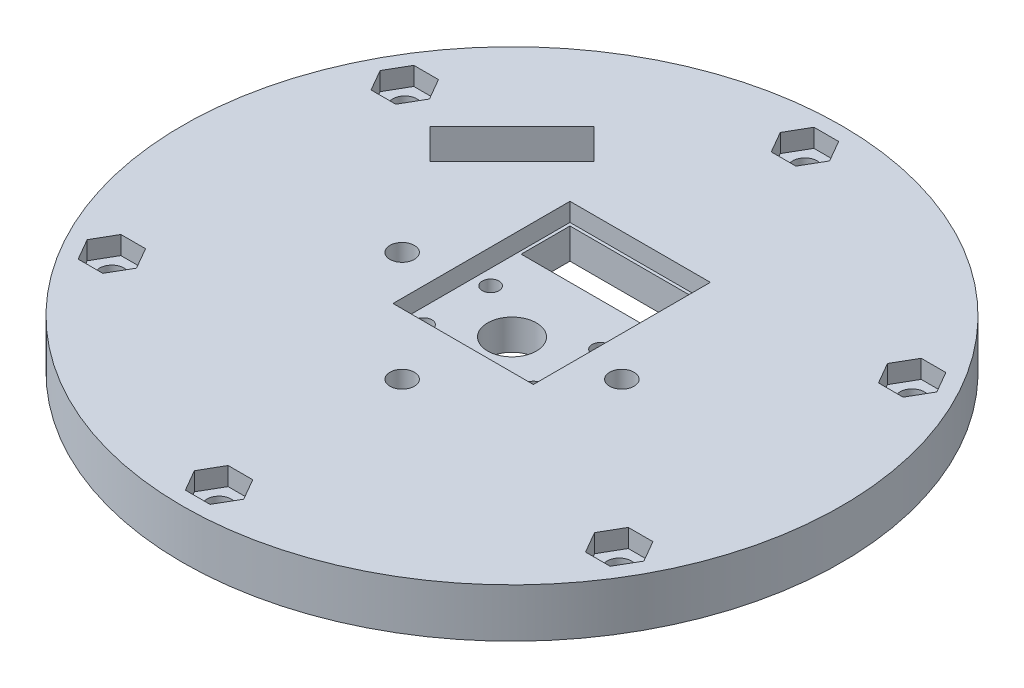
from build123d import *

# Parameters (mm, degrees)
SKETCH1_R                       = 54
BASE_PLATE_DEPTH                = 8
HOLE_PATTERN_R                  = 2
MOTOR_MOUNT_HOLES_DEPTH         = 77.785415282
SKETCH3_R                       = 1.375
SKETCH3_R_2                     = 4
ENCODER_MOUNTING_HOLES_DEPTH    = 77.785415282
SKETCH4_W                       = 22
SKETCH4_H                       = 8
ENCODER_WIRE_PASS_THROUGH_DEPTH = 5
MOTOR_WIRE_PASS_THROUGH_DEPTH   = 77.785415282
SKETCH6_W                       = 11.998985868
SKETCH6_H                       = 14
CUT_EXTRUDE6_DEPTH              = 2
CUT_EXTRUDE7_DEPTH              = 2
CUT_EXTRUDE8_DEPTH              = 3
SKETCH10_W                      = 23
SKETCH10_H                      = 29
CUT_EXTRUDE9_DEPTH              = 3


with BuildPart() as part:
    # Sketch1 → Base Plate (new body)
    with BuildSketch(Plane(origin=(0, 0, 0), x_dir=(1, 0, 0), z_dir=(0, 1, 0))):
        with Locations(Location((0, 0, 0), (0, 0, 270))):
            Circle(SKETCH1_R)
    extrude(amount=BASE_PLATE_DEPTH)

    # Hole Pattern → Motor Mount Holes (cut, through all)
    with BuildSketch(Plane.XZ):
        with Locations(Location((0, 48, 0), (0, 0, 270))):
            Circle(HOLE_PATTERN_R)
        with Locations(Location((41.569219382, 24, 0), (0, 0, 270))):
            Circle(HOLE_PATTERN_R)
        with Locations(Location((41.569219382, -24, 0), (0, 0, 270))):
            Circle(HOLE_PATTERN_R)
        with Locations(Location((0, -48, 0), (0, 0, 270))):
            Circle(HOLE_PATTERN_R)
        with Locations(Location((-41.569219382, -24, 0), (0, 0, 270))):
            Circle(HOLE_PATTERN_R)
        with Locations(Location((-41.569219382, 24, 0), (0, 0, 270))):
            Circle(HOLE_PATTERN_R)
        with Locations(Location((0, 18, 0), (0, 0, 270))):
            Circle(HOLE_PATTERN_R)
        with Locations(Location((18, 0, 0), (0, 0, 270))):
            Circle(HOLE_PATTERN_R)
        with Locations(Location((-18, 0, 0), (0, 0, 270))):
            Circle(HOLE_PATTERN_R)
    extrude(amount=-MOTOR_MOUNT_HOLES_DEPTH, mode=Mode.SUBTRACT)

    # Sketch3 → Encoder mounting holes (cut, through all)
    with BuildSketch(Plane(origin=(0, 8, 0), x_dir=(1, 0, 0), z_dir=(0, 1, 0))):
        with Locations(Location((-9, 5.5, 0), (0, 0, 270))):
            Circle(SKETCH3_R)
        with Locations(Location((9, 5.5, 0), (0, 0, 270))):
            Circle(SKETCH3_R)
        with Locations(Location((9, -5.5, 0), (0, 0, 270))):
            Circle(SKETCH3_R)
        with Locations(Location((-9, -5.5, 0), (0, 0, 270))):
            Circle(SKETCH3_R)
        with Locations(Location((0, 0, 0), (0, 0, 270))):
            Circle(SKETCH3_R_2)
    extrude(amount=-ENCODER_MOUNTING_HOLES_DEPTH, mode=Mode.SUBTRACT)

    # Sketch4 → Encoder Wire Pass through (cut)
    with BuildSketch(Plane(origin=(0, 0, 0), x_dir=(1, 0, 0), z_dir=(0, 1, 0))):
        with Locations((0, 16.5)):
            Rectangle(SKETCH4_W, SKETCH4_H)
    extrude(amount=ENCODER_WIRE_PASS_THROUGH_DEPTH, mode=Mode.SUBTRACT)

    # Sketch5 → Motor Wire pass through (cut, through all)
    with BuildSketch(Plane(origin=(0, 8, 0), x_dir=(1, 0, 0), z_dir=(0, 1, 0))):
        Polygon((-33.587572106, 20.152543264), (-28.637824638, 15.202795796), (-15.202795796, 28.637824638), (-20.152543264, 33.587572106), align=None)
    extrude(amount=-MOTOR_WIRE_PASS_THROUGH_DEPTH, mode=Mode.SUBTRACT)

    # Sketch6 → Cut-Extrude6 (cut)
    with BuildSketch(Plane(origin=(0, 8, 0), x_dir=(1, 0, 0), z_dir=(0, 1, 0))):
        with Locations((0, 12.5)):
            Rectangle(SKETCH6_W, SKETCH6_H)
    extrude(amount=-CUT_EXTRUDE6_DEPTH, mode=Mode.SUBTRACT)

    # Sketch7 → Cut-Extrude7 (cut)
    with BuildSketch(Plane.XZ):
        Polygon((7.556624327, 3), (10.443375673, 3), (11.886751346, 5.5), (10.443375673, 8), (7.556624327, 8), (6.113248654, 5.5), align=None)
        Polygon((10.443375673, -8), (11.886751346, -5.5), (10.443375673, -3), (7.556624327, -3), (6.113248654, -5.5), (7.556624327, -8), align=None)
        Polygon((-7.556624327, -8), (-6.113248654, -5.5), (-7.556624327, -3), (-10.443375673, -3), (-11.886751346, -5.5), (-10.443375673, -8), align=None)
        Polygon((-7.556624327, 3), (-6.113248654, 5.5), (-7.556624327, 8), (-10.443375673, 8), (-11.886751346, 5.5), (-10.443375673, 3), align=None)
    extrude(amount=-CUT_EXTRUDE7_DEPTH, mode=Mode.SUBTRACT)

    # Sketch9 → Cut-Extrude8 (cut)
    with BuildSketch(Plane.XZ.offset(-8)):
        Polygon((39.548493439, -27.5), (43.589945324, -27.5), (45.610671266, -24), (43.589945324, -20.5), (39.548493439, -20.5), (37.527767497, -24), align=None)
        Polygon((-4.041451884, -48), (-2.020725942, -51.5), (2.020725942, -51.5), (4.041451884, -48), (2.020725942, -44.5), (-2.020725942, -44.5), align=None)
        Polygon((43.589945324, 20.5), (45.610671266, 24), (43.589945324, 27.5), (39.548493439, 27.5), (37.527767497, 24), (39.548493439, 20.5), align=None)
        Polygon((4.041451884, 48), (2.020725942, 51.5), (-2.020725942, 51.5), (-4.041451884, 48), (-2.020725942, 44.5), (2.020725942, 44.5), align=None)
        Polygon((-39.548493439, 27.5), (-43.589945324, 27.5), (-45.610671266, 24), (-43.589945324, 20.5), (-39.548493439, 20.5), (-37.527767497, 24), align=None)
        Polygon((-43.589945324, -20.5), (-45.610671266, -24), (-43.589945324, -27.5), (-39.548493439, -27.5), (-37.527767497, -24), (-39.548493439, -20.5), align=None)
    extrude(amount=CUT_EXTRUDE8_DEPTH, mode=Mode.SUBTRACT)

    # Sketch10 → Cut-Extrude9 (cut)
    with BuildSketch(Plane(origin=(0, 8, 0), x_dir=(1, 0, 0), z_dir=(0, 1, 0))):
        with Locations((0, 6.5)):
            Rectangle(SKETCH10_W, SKETCH10_H)
    extrude(amount=-CUT_EXTRUDE9_DEPTH, mode=Mode.SUBTRACT)


solid = part.part
